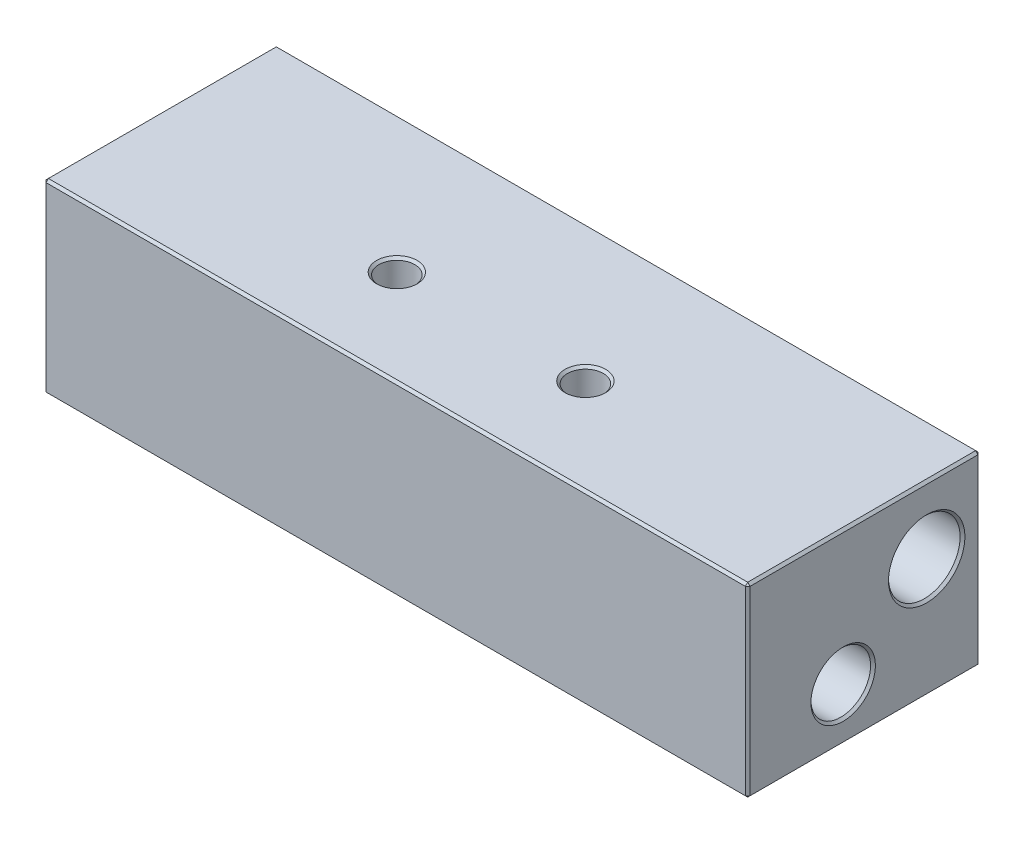
from build123d import *

# Parameters (mm, degrees)
SKETCH1_W           = 59
SKETCH1_H           = 15.6
BOSS_EXTRUDE1_DEPTH = 19.5
SKETCH2_R           = 3
CUT_EXTRUDE1_DEPTH  = 2
SKETCH3_R           = 3
SKETCH3_R_2         = 2.5
CUT_EXTRUDE2_DEPTH  = 5
SKETCH4_R           = 1.5
CUT_EXTRUDE3_DEPTH  = 65.067230313
CHAMFER1_SIZE       = 0.2


with BuildPart() as part:
    # Sketch1 → Boss-Extrude1 (new body)
    with BuildSketch(Plane.XY):
        with Locations((29.5, 7.8)):
            Rectangle(SKETCH1_W, SKETCH1_H)
    extrude(amount=BOSS_EXTRUDE1_DEPTH)

    # Sketch2 → Cut-Extrude1 (cut)
    with BuildSketch(Plane.ZY):
        with Locations((10.4, 10.7)):
            Circle(SKETCH2_R)
        with Locations((4.5, 4.6)):
            Circle(SKETCH2_R)
    extrude(amount=-CUT_EXTRUDE1_DEPTH, mode=Mode.SUBTRACT)

    # Sketch3 → Cut-Extrude2 (cut)
    with BuildSketch(Plane(origin=(59, 0, 0), x_dir=(0, 0, -1), z_dir=(1, 0, 0))):
        with Locations((-4.5, 10)):
            Circle(SKETCH3_R)
        with Locations((-11.5, 4.4)):
            Circle(SKETCH3_R_2)
    extrude(amount=-CUT_EXTRUDE2_DEPTH, mode=Mode.SUBTRACT)

    # Sketch4 → Cut-Extrude3 (cut, through all)
    with BuildSketch(Plane.XZ):
        with Locations(Location((21.6, 11.5, 0), (0, 0, 270))):
            Circle(SKETCH4_R)
        with Locations(Location((37.4, 11.5, 0), (0, 0, 270))):
            Circle(SKETCH4_R)
    extrude(amount=-CUT_EXTRUDE3_DEPTH, mode=Mode.SUBTRACT)

    # Chamfer1
    chamfer1_edges = [part.edges().sort_by_distance(p)[0] for p in [
        (59, 7.8, 19.5),
        (29.5, 15.6, 19.5),
        (54, 10, 7.5),
        (59, 10, 7.5),
        (59, 4.4, 14),
        (21.6, 15.6, 13),
        (21.6, 0, 13),
        (37.4, 15.6, 13),
        (37.4, 0, 13),
        (0, 7.8, 19.5),
        (29.5, 15.6, 0),
        (59, 7.8, 0),
        (29.5, 0, 0),
        (0, 7.8, 0),
        (0, 15.6, 9.75),
        (59, 15.6, 9.75),
        (59, 0, 9.75),
        (0, 0, 9.75),
        (29.5, 0, 19.5),
    ]]
    chamfer(chamfer1_edges, length=CHAMFER1_SIZE)


solid = part.part
